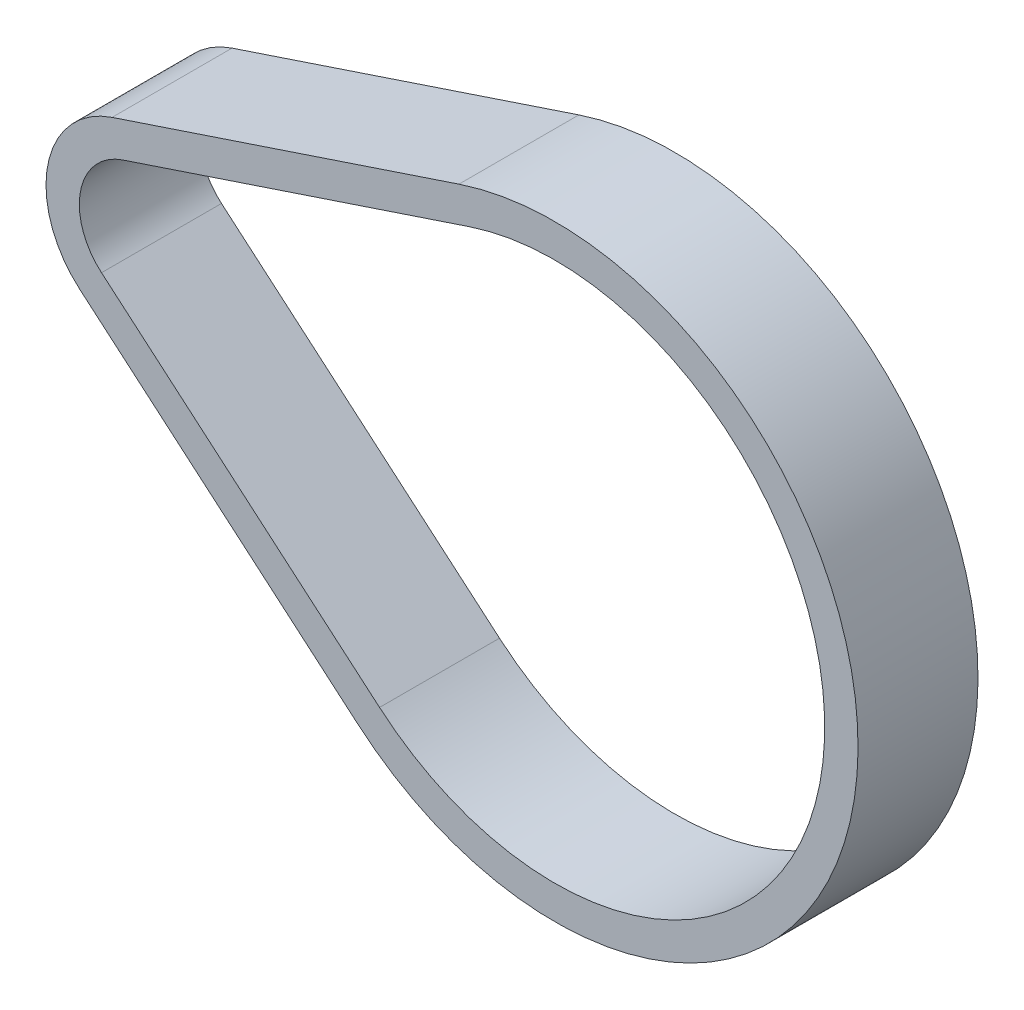
from build123d import *

# Parameters (mm, degrees)
EXTRUDE_THIN1_DEPTH      = 28
EXTRUDE_THIN1_DEPTH_BACK = 8


with BuildPart() as part:
    # Sketch1 → Extrude-Thin1 (new, two sides: drawn at the far end of the back side and taken through both)
    with BuildSketch(Plane.XY.offset(-EXTRUDE_THIN1_DEPTH_BACK)):
        with BuildLine():
            Line((174.602281923, 28.680951152), (91.165095139, 99.94900549))
            ThreePointArc((91.165095139, 99.94900549), (81.536210927, 127.550919887), (100.830770089, 149.51227404))
            Line((100.830770089, 149.51227404), (204.932503319, 184.207069705))
            ThreePointArc((204.932503319, 184.207069705), (323.02232151, 80.457047384), (174.602281923, 28.680951152))
        make_face()
        with BuildLine():
            Line((181.097076703, 36.284742362), (97.659889919, 107.5527967))
            ThreePointArc((97.659889919, 107.5527967), (91.351310607, 125.636809581), (103.992573507, 140.025282992))
            Line((103.992573507, 140.025282992), (208.094306736, 174.720078656))
            ThreePointArc((208.094306736, 174.720078656), (313.20722183, 82.371157689), (181.097076703, 36.284742362))
        make_face(mode=Mode.SUBTRACT)
    extrude(amount=EXTRUDE_THIN1_DEPTH + EXTRUDE_THIN1_DEPTH_BACK)


solid = part.part
